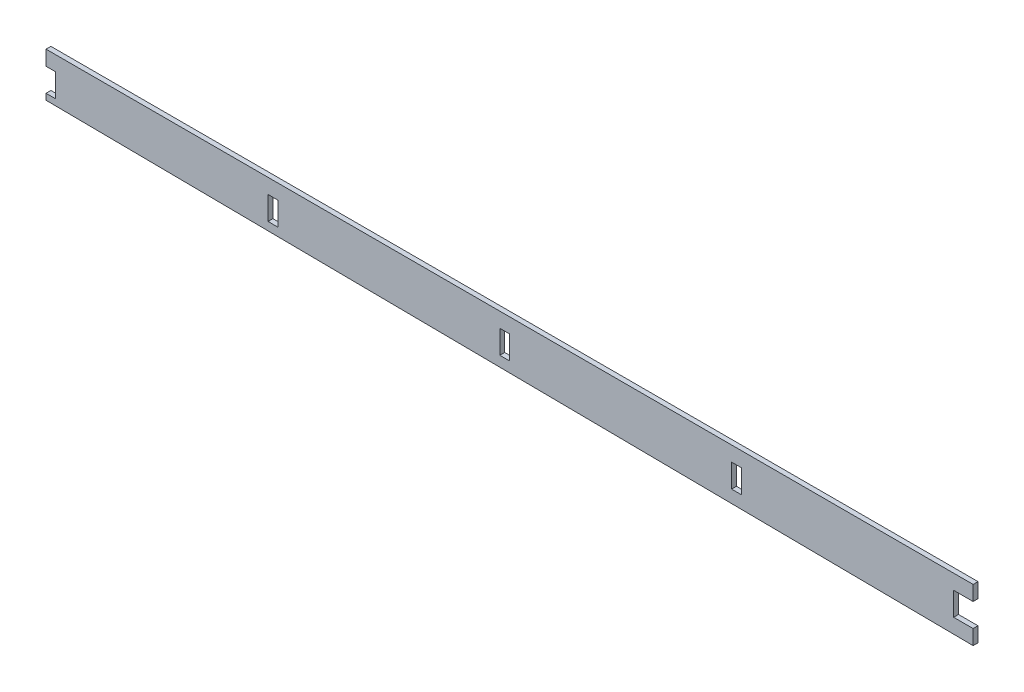
from build123d import *

# Parameters (mm, degrees)
SKETCH1_W           = 3.175
SKETCH1_H           = 7.62
BOSS_EXTRUDE1_DEPTH = 1.5875


with BuildPart() as part:
    # Sketch1 → Boss-Extrude1 (new body)
    with BuildSketch(Plane.XY):
        Polygon((88.325743431, -43.512525906), (88.325743431, -48.351404921), (-213.934256569, -45.480884503), (-213.934256569, -43.512525906), (-210.759256569, -43.512525906), (-210.759256569, -35.892525906), (-213.934256569, -35.892525906), (-213.934256569, -31.053594044), (88.325743431, -31.053594044), (88.325743431, -35.892525906), (81.975743431, -35.892525906), (81.975743431, -43.512525906), align=None)
        with Locations((11.173243431, -39.702525906)):
            Rectangle(SKETCH1_W, SKETCH1_H, mode=Mode.SUBTRACT)
        with Locations((-64.391756569, -39.702525906)):
            Rectangle(SKETCH1_W, SKETCH1_H, mode=Mode.SUBTRACT)
        with Locations((-139.956756569, -39.702525906)):
            Rectangle(SKETCH1_W, SKETCH1_H, mode=Mode.SUBTRACT)
    extrude(amount=BOSS_EXTRUDE1_DEPTH)


solid = part.part
